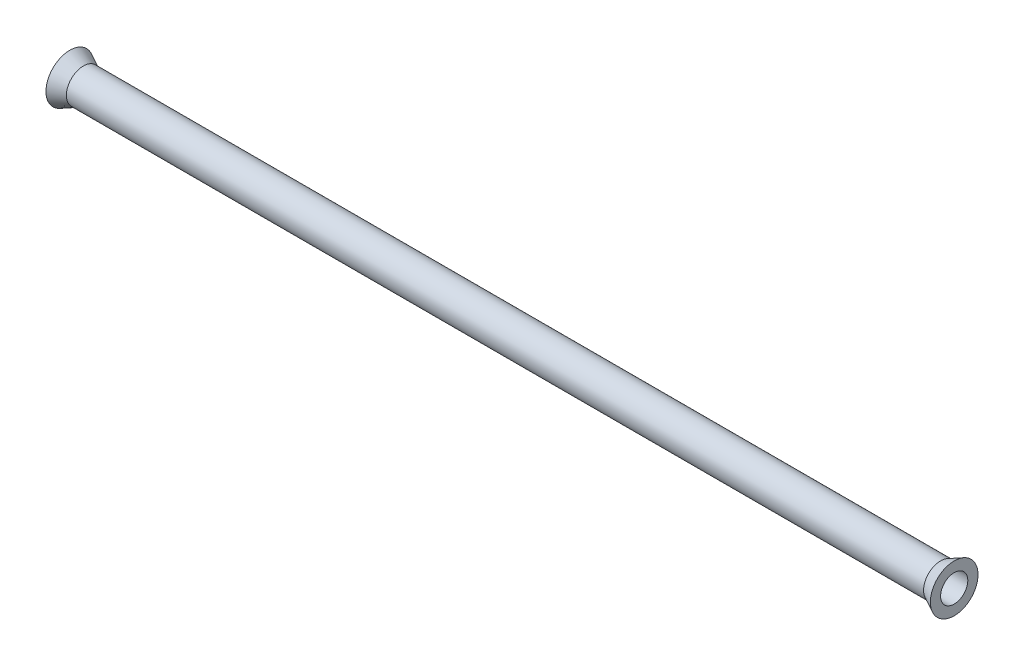
from build123d import *


with BuildPart() as part:
    # Эскиз1 → Повернуть1 (revolve)
    with BuildSketch(Plane.XY, mode=Mode.PRIVATE) as revolve_1_sk:
        Polygon((-4, 5), (-256, 5), (-260, 7), (-260, 4), (0, 4), (0, 7), align=None)
    revolve(revolve_1_sk.sketch.rotate(Axis((0, 0, 0), (-1, 0, 0)), 90), axis=Axis((0, 0, 0), (-1, 0, 0)))


solid = part.part
